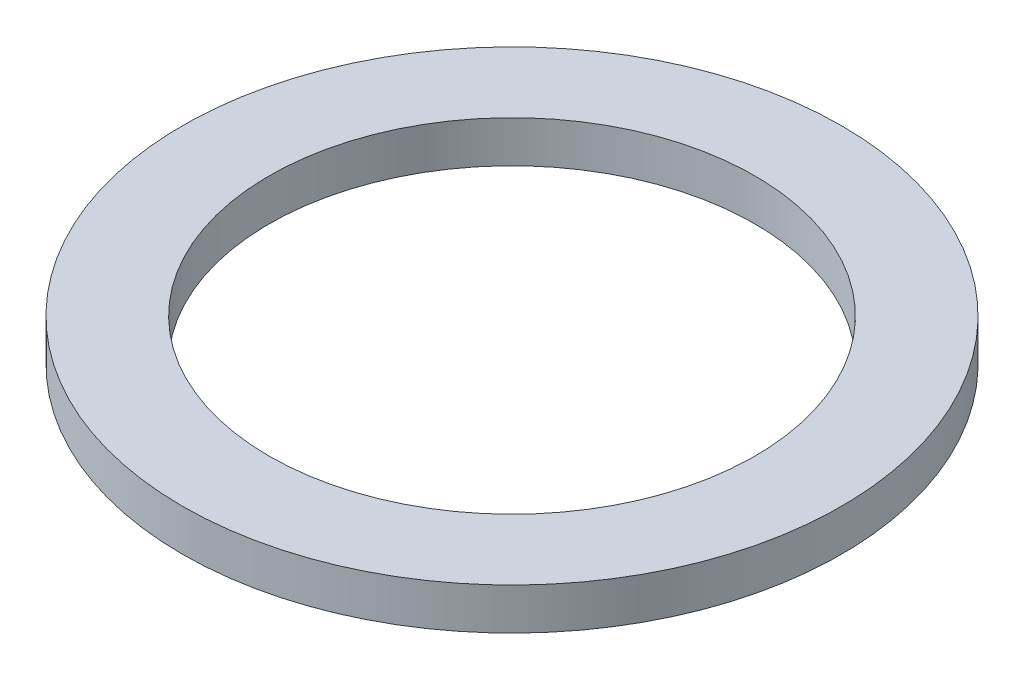
from build123d import *

# Parameters (mm, degrees)
SKETCH_1_R      = 47.5
SKETCH_1_R_2    = 35
EXTRUDE_1_DEPTH = 6


with BuildPart() as part:
    # 草图1 → 凸台-拉伸1 (new body)
    with BuildSketch(Plane(origin=(0, 0, 0), x_dir=(1, 0, 0), z_dir=(0, 1, 0))):
        with Locations(Location((0, 0, 0), (0, 0, 270))):
            Circle(SKETCH_1_R)
        with Locations(Location((0, 0, 0), (0, 0, 270))):
            Circle(SKETCH_1_R_2, mode=Mode.SUBTRACT)
    extrude(amount=EXTRUDE_1_DEPTH)


solid = part.part
